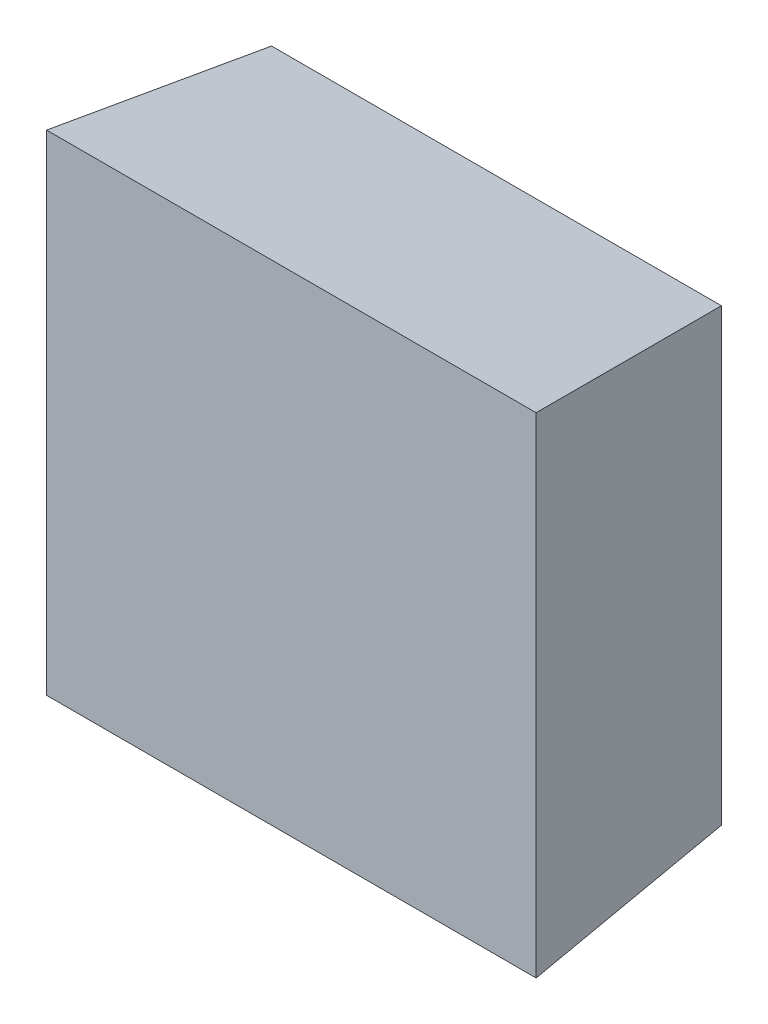
from build123d import *

# Parameters (mm, degrees)
SKETCH1_W           = 40
SKETCH1_H           = 40
BOSS_EXTRUDE1_DEPTH = 20
DRAFT1_ANGLE        = 10


with BuildPart() as part:
    # Sketch1 → Boss-Extrude1 (new body)
    with BuildSketch(Plane.XY):
        with Locations((20, 20)):
            Rectangle(SKETCH1_W, SKETCH1_H)
    extrude(amount=BOSS_EXTRUDE1_DEPTH)

    # Draft1
    draft1_faces = [part.faces().sort_by_distance(p)[0] for p in [
        (20, 40, 10),
        (40, 20, 10),
    ]]
    draft(draft1_faces, Plane(origin=(0, 0, 0), x_dir=(-1, 0, 0), z_dir=(0, 0, -1)), DRAFT1_ANGLE)


solid = part.part
